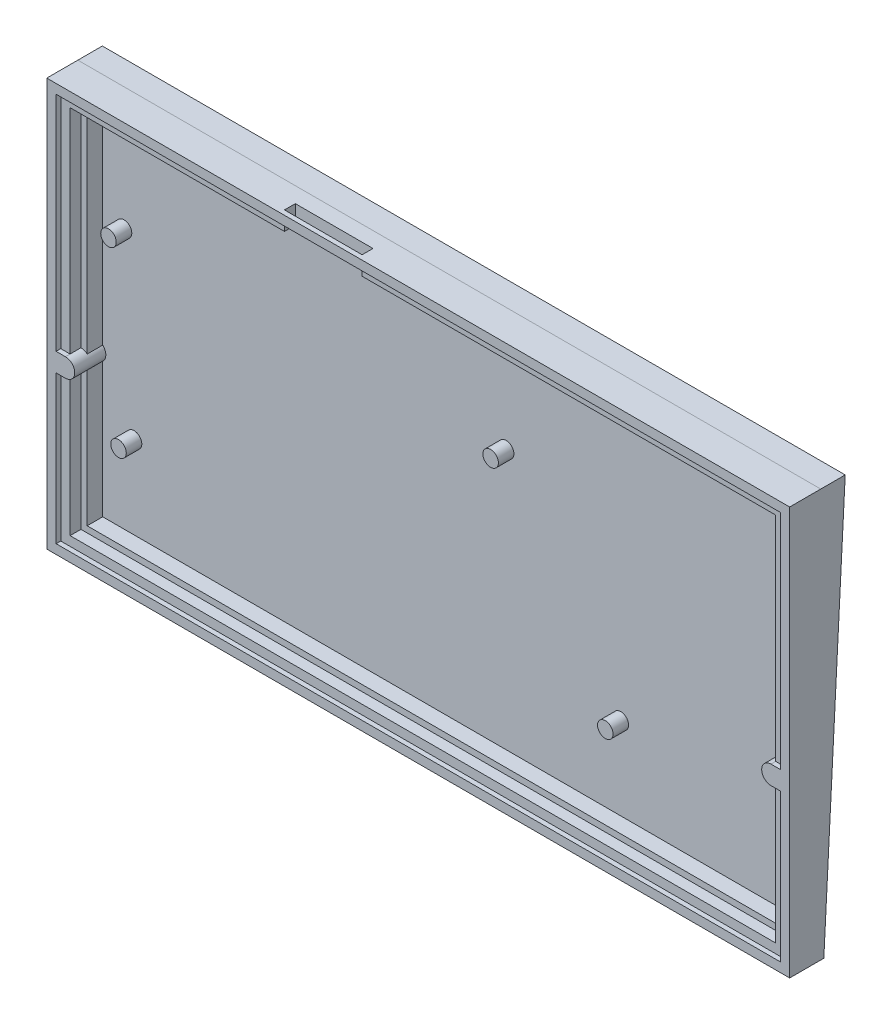
from build123d import *

# Parameters (mm, degrees)
MODEL_W             = 239.114
MODEL_H             = 131.298938207
EXTRUDE_2_DEPTH     = 10
EXTRUDE_3_DEPTH     = 8.5
EXTRUDE_4_DEPTH     = 5
SKETCH_3_R          = 2.5
EXTRUDE_5_DEPTH     = 5
EXTRUDE_5_2_DEPTH   = 5
EXTRUDE_5_3_DEPTH   = 5
EXTRUDE_5_4_DEPTH   = 5
EXTRUDE_6_DEPTH     = 239.114
SKETCH_5_W          = 25
SKETCH_5_H          = 5.998631207
CUT_EXTRUDE_1_DEPTH = 3.5


with BuildPart() as part:
    # Model → 凸台-拉伸2 (new body)
    with BuildSketch(Plane.XY):
        with Locations((559.31883528, 226.885059923)):
            Rectangle(MODEL_W, MODEL_H)
        with BuildLine():
            Line((442.76183528, 289.535897819), (675.87583528, 289.535897819))
            Line((675.87583528, 289.535897819), (675.87583528, 217.861297819))
            Line((675.87583528, 217.861297819), (672.87583528, 217.861297819))
            ThreePointArc((672.87583528, 217.861297819), (671.805369011, 217.663814896), (670.87583528, 217.097365797))
            ThreePointArc((670.87583528, 217.097365797), (669.87583528, 214.861297819), (670.87583528, 212.625229842))
            ThreePointArc((670.87583528, 212.625229842), (671.805369011, 212.058780742), (672.87583528, 211.861297819))
            Line((672.87583528, 211.861297819), (675.87583528, 211.861297819))
            Line((675.87583528, 211.861297819), (675.87583528, 164.235590819))
            Line((675.87583528, 164.235590819), (442.76183528, 164.235590819))
            Line((442.76183528, 164.235590819), (442.76183528, 211.861297819))
            Line((442.76183528, 211.861297819), (445.76183528, 211.861297819))
            ThreePointArc((445.76183528, 211.861297819), (446.832301549, 212.058780742), (447.76183528, 212.625229842))
            ThreePointArc((447.76183528, 212.625229842), (448.76183528, 214.861297819), (447.76183528, 217.097365797))
            ThreePointArc((447.76183528, 217.097365797), (446.832301549, 217.663814896), (445.76183528, 217.861297819))
            Line((445.76183528, 217.861297819), (442.76183528, 217.861297819))
            Line((442.76183528, 217.861297819), (442.76183528, 289.535897819))
        make_face(mode=Mode.SUBTRACT)
    extrude(amount=EXTRUDE_2_DEPTH)

    # Model<4> → 凸台-拉伸3 (add)
    with BuildSketch(Plane.XY):
        Polygon((445.76183528, 167.235590819), (445.76183528, 211.861297819), (442.76183528, 211.861297819), (442.76183528, 164.235590819), (675.87583528, 164.235590819), (675.87583528, 211.861297819), (672.87583528, 211.861297819), (672.87583528, 167.235590819), align=None)
        Polygon((442.76183528, 217.861297819), (442.76183528, 289.535897819), (675.87583528, 289.535897819), (675.87583528, 217.861297819), (672.87583528, 217.861297819), (672.87583528, 286.535897819), (445.76183528, 286.535897819), (445.76183528, 217.861297819), align=None)
    extrude(amount=EXTRUDE_3_DEPTH)

    # Model<5> → 凸台-拉伸4 (add)
    with BuildSketch(Plane.XY):
        with BuildLine():
            ThreePointArc((672.87583528, 211.861297819), (671.805369011, 212.058780742), (670.87583528, 212.625229842))
            Line((670.87583528, 212.625229842), (670.87583528, 169.235590819))
            Line((670.87583528, 169.235590819), (447.76183528, 169.235590819))
            Line((447.76183528, 169.235590819), (447.76183528, 212.625229842))
            ThreePointArc((447.76183528, 212.625229842), (446.832301549, 212.058780742), (445.76183528, 211.861297819))
            Line((445.76183528, 211.861297819), (445.76183528, 167.235590819))
            Line((445.76183528, 167.235590819), (672.87583528, 167.235590819))
            Line((672.87583528, 167.235590819), (672.87583528, 211.861297819))
        make_face()
        with BuildLine():
            ThreePointArc((670.87583528, 217.097365797), (671.805369011, 217.663814896), (672.87583528, 217.861297819))
            Line((672.87583528, 217.861297819), (672.87583528, 286.535897819))
            Line((672.87583528, 286.535897819), (539.76183528, 286.535897819))
            Line((539.76183528, 286.535897819), (514.76183528, 286.535897819))
            Line((514.76183528, 286.535897819), (445.76183528, 286.535897819))
            Line((445.76183528, 286.535897819), (445.76183528, 217.861297819))
            ThreePointArc((445.76183528, 217.861297819), (446.832301549, 217.663814896), (447.76183528, 217.097365797))
            Line((447.76183528, 217.097365797), (447.76183528, 284.535897819))
            Line((447.76183528, 284.535897819), (670.87583528, 284.535897819))
            Line((670.87583528, 284.535897819), (670.87583528, 217.097365797))
        make_face()
    extrude(amount=EXTRUDE_4_DEPTH)



with BuildPart() as body_2:
    # 草图3 → 凸台-拉伸5 (new body)
    with BuildSketch(Plane(origin=(0, 0, 0), x_dir=(-1, 0, 0), z_dir=(0, 0, -1))):
        with Locations((-577.62472278, 252.961297819)):
            Circle(SKETCH_3_R)
    extrude(amount=-EXTRUDE_5_DEPTH)


with BuildPart() as body_3:
    # 草图3 → Extrude 5 2 (new body)
    with BuildSketch(Plane(origin=(0, 0, 0), x_dir=(-1, 0, 0), z_dir=(0, 0, -1))):
        with Locations((-614.53372278, 195.811572819)):
            Circle(SKETCH_3_R)
    extrude(amount=-EXTRUDE_5_2_DEPTH)


with BuildPart() as body_4:
    # 草图3 → Extrude 5 3 (new body)
    with BuildSketch(Plane(origin=(0, 0, 0), x_dir=(-1, 0, 0), z_dir=(0, 0, -1))):
        with Locations((-457.84983528, 195.811597819)):
            Circle(SKETCH_3_R)
    extrude(amount=-EXTRUDE_5_3_DEPTH)


with BuildPart() as body_5:
    # 草图3 → Extrude 5 4 (new body)
    with BuildSketch(Plane(origin=(0, 0, 0), x_dir=(-1, 0, 0), z_dir=(0, 0, -1))):
        with Locations((-454.62472278, 252.961297819)):
            Circle(SKETCH_3_R)
    extrude(amount=-EXTRUDE_5_4_DEPTH)


with BuildPart() as part_1:
    add(part.part)

    add(body_2.part)  # 凸台-拉伸6 merges body 2

    add(body_3.part)  # 凸台-拉伸6 merges body 3

    add(body_4.part)  # 凸台-拉伸6 merges body 4

    add(body_5.part)  # 凸台-拉伸6 merges body 5
    # 草图4 → 凸台-拉伸6 (add)
    with BuildSketch(Plane.ZY.offset(-439.76183528)):
        Polygon((-7.881170053, 292.536137164), (-1, 161.235590819), (0, 161.235590819), (0, 292.534529026), align=None)
    extrude(amount=-EXTRUDE_6_DEPTH)

    # 草图5 → 切除-拉伸1 (cut)
    with BuildSketch(Plane.XY.offset(8.5)):
        with Locations((527.26183528, 289.535213423)):
            Rectangle(SKETCH_5_W, SKETCH_5_H)
    extrude(amount=-CUT_EXTRUDE_1_DEPTH, mode=Mode.SUBTRACT)


solid = part_1.part
